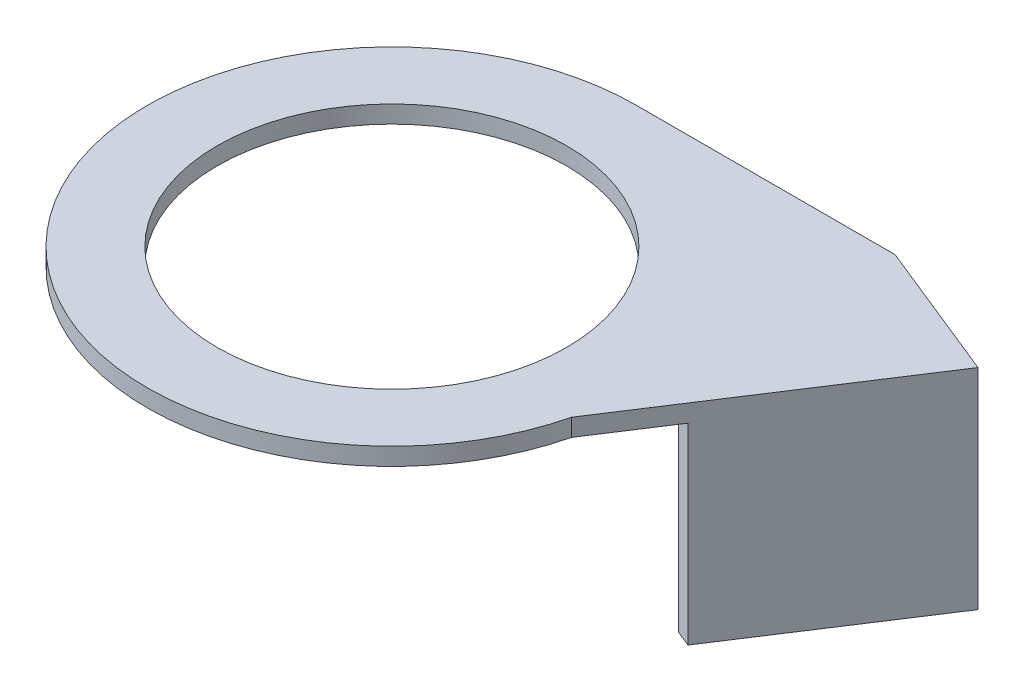
from build123d import *

# Parameters (mm, degrees)
SKETCH1_R           = 14
BOSS_EXTRUDE1_DEPTH = 1
BOSS_EXTRUDE2_DEPTH = 11
BOSS_EXTRUDE3_DEPTH = 11
SKETCH4_R           = 10
CUT_EXTRUDE1_DEPTH  = 11


with BuildPart() as part:
    # Sketch1 → Boss-Extrude1 (new body)
    with BuildSketch(Plane(origin=(0, 0, 0), x_dir=(1, 0, 0), z_dir=(0, 1, 0))):
        Circle(SKETCH1_R)
        with BuildLine():
            Line((14.805399496, 14), (0, 14))
            ThreePointArc((0, 14), (9.899494937, 9.899494937), (14, 0))
            ThreePointArc((14, 0), (13.900075645, -1.66969969), (13.601728992, -3.31556457))
            Line((13.601728992, -3.31556457), (22.770248109, 10.778060096))
            Line((22.770248109, 10.778060096), (14.805399496, 14))
        make_face()
    extrude(amount=BOSS_EXTRUDE1_DEPTH)

    # Sketch2 → Boss-Extrude2 (add)
    with BuildSketch(Plane(origin=(0, 0, 0), x_dir=(-1, 0, 0), z_dir=(0, -1, 0))):
        Polygon((-22.770248109, 10.778060096), (-21.843223298, 11.153060096), (-15.299518751, 1.094236567), (-16.226543561, 0.719236567), align=None)
    extrude(amount=BOSS_EXTRUDE2_DEPTH)

    # Sketch3 → Boss-Extrude3 (add)
    with BuildSketch(Plane(origin=(0, 0, 0), x_dir=(-1, 0, 0), z_dir=(0, -1, 0))):
        with BuildLine():
            Line((-18.06544552, 12.681246451), (-14.398150781, 7.043970142))
            ThreePointArc((-14.398150781, 7.043970142), (-11.63382994, 11.026253317), (-7.805399496, 14))
            Line((-7.805399496, 14), (-14.805399496, 14))
            Line((-14.805399496, 14), (-18.06544552, 12.681246451))
        make_face()
    extrude(amount=BOSS_EXTRUDE3_DEPTH)

    # Sketch4 → Cut-Extrude1 (cut)
    with BuildSketch(Plane.XZ):
        with Locations(Location((0, 0, 0), (0, 0, 270))):
            Circle(SKETCH4_R)
    extrude(amount=-CUT_EXTRUDE1_DEPTH, mode=Mode.SUBTRACT)


solid = part.part
